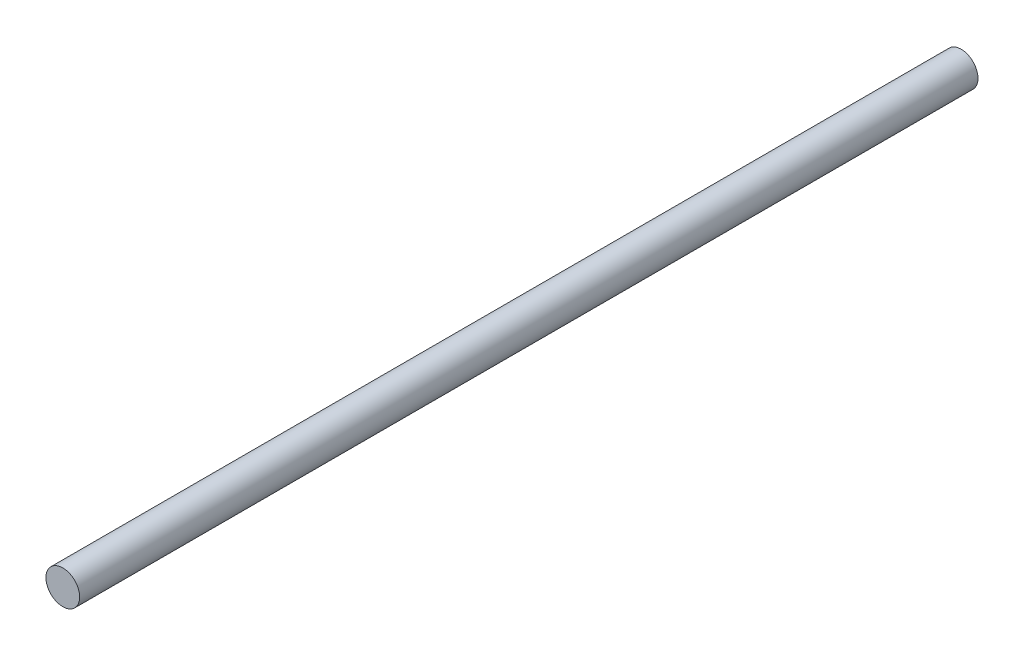
from build123d import *

# Parameters (mm, degrees)
SKETCH1_R           = 7.5
BOSS_EXTRUDE1_DEPTH = 400


with BuildPart() as part:
    # Sketch1 → Boss-Extrude1 (new body)
    with BuildSketch(Plane.XY):
        Circle(SKETCH1_R)
    extrude(amount=BOSS_EXTRUDE1_DEPTH)


solid = part.part
